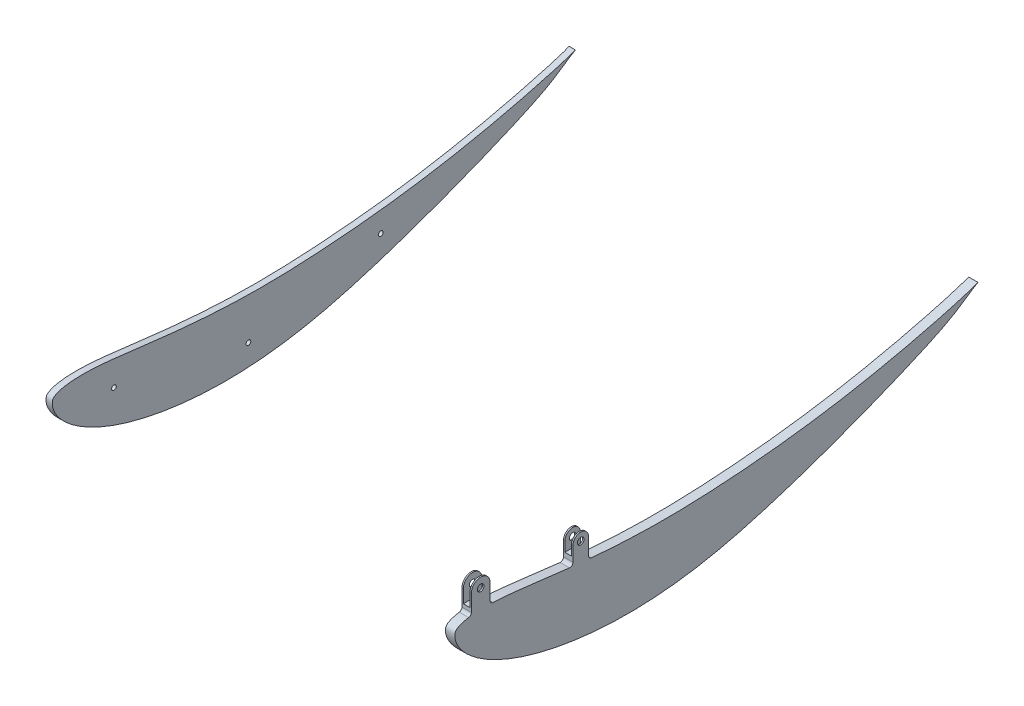
from build123d import *

# Parameters (mm, degrees)
SKETCH10_R          = 3.3782
BOSS_EXTRUDE3_DEPTH = 4.7625
FILLET1_R           = 3.175
SKETCH11_W          = 49.180841289
SKETCH11_H          = 41.157995699
SKETCH11_W_2        = 33.005126503
SKETCH11_H_2        = 27.785711149
CUT_EXTRUDE2_DEPTH  = 3.3782
BOSS_EXTRUDE4_DEPTH = 6.35
SKETCH13_R          = 2.413
CUT_EXTRUDE3_DEPTH  = 6.35


with BuildPart() as part:
    # Sketch10 → Boss-Extrude3 (new, symmetric)
    with BuildSketch(Plane(origin=(-76.913317281, 0, 0), x_dir=(0, 0, -1), z_dir=(1, 0, 0))):
        with BuildLine():
            Line((424.6411251, 925.56881761), (424.6411251, 905.857301798))
            add(Edge.make_bspline(
                [(424.6411251, 905.857301798), (423.945652944, 905.774703814), (420.525882084, 905.325504915), (416.573283914, 904.537907427), (412.940662307, 903.120412878), (411.573177088, 902.472936622), (410.474599814, 901.817379847), (409.794744242, 901.335782482), (409.339677052, 900.920330878), (409.042207277, 900.619525556), (408.784556315, 900.303921905), (408.587304247, 899.955317553), (408.417771895, 899.584396657), (408.237439409, 899.045054034), (408.050985255, 898.323866051), (407.911585152, 897.226493937), (407.859927906, 894.999149718), (408.68651392, 890.840217441), (411.376000996, 884.946014898), (416.25391737, 878.254816024), (423.132675249, 871.411144687), (431.981552695, 864.594650088), (442.753920117, 857.982519555), (455.382043243, 851.727453866), (469.76495433, 845.961461457), (485.786519626, 840.806471362), (503.304073155, 836.369991877), (522.15856297, 832.757498728), (542.167589645, 830.052058954), (563.145876614, 828.350450786), (584.926560949, 827.796453196), (607.349161879, 828.463904852), (630.278164353, 830.40345119), (653.58544904, 833.656986938), (677.184512168, 838.243674796), (700.98973836, 844.111293992), (724.928449617, 850.915307518), (748.823162114, 858.397918758), (772.401865862, 866.368085261), (795.392079425, 874.604570932), (817.507453816, 882.912333682), (838.451534111, 891.127800517), (857.939094567, 899.08092447), (875.67746411, 906.643284295), (891.41607084, 913.715551659), (904.921254426, 920.249689629), (916.209983753, 926.570936945), (924.887186218, 932.328637386), (932.384753705, 937.363798289), (935.676703204, 939.716333859), (940.314704509, 942.154799385), (935.252865423, 940.050693146), (930.971572534, 938.763984852), (920.691607442, 935.460998702), (907.955315783, 931.908700898), (891.294887337, 927.47431092), (871.521761407, 922.604159426), (848.573928973, 917.416460042), (822.769468157, 912.150284242), (794.390431685, 907.047528902), (763.843566945, 902.44822661), (731.632596414, 898.583575164), (698.294192795, 895.504846252), (664.329350338, 893.303833795), (630.291363455, 892.15873472), (596.91773512, 892.45793122), (568.119025793, 893.993021629), (550.570865957, 895.432987488), (543.7036251, 896.066896175)],
                knots=[0.465548295, 0.465548295, 0.465548295, 0.465548295, 0.467425396, 0.47478648, 0.476279685, 0.477883717, 0.478839792, 0.479711359, 0.480113154, 0.480492024, 0.480846456, 0.481202587, 0.481563638, 0.481939612, 0.482727348, 0.483558572, 0.484902837, 0.488691659, 0.494806066, 0.502149414, 0.51079641, 0.520764117, 0.532061881, 0.544665778, 0.558541304, 0.573611819, 0.589802913, 0.607010014, 0.625106992, 0.64396663, 0.663469284, 0.683551422, 0.704141715, 0.725196117, 0.746680345, 0.768632951, 0.790977273, 0.813463266, 0.835826601, 0.857771603, 0.879002655, 0.899227861, 0.918150719, 0.935487385, 0.95098692, 0.964427758, 0.975827857, 0.985423652, 0.993088672, 0.998187309, 1, 1.001841176, 1.007308484, 1.016237151, 1.028456325, 1.043801368, 1.062125827, 1.083239553, 1.106895519, 1.132816624, 1.160612712, 1.18979101, 1.219873156, 1.250457487, 1.281126556, 1.311256566, 1.339998753, 1.35850705, 1.35850705, 1.35850705, 1.35850705], degree=3))
            Line((543.7036251, 896.066896175), (543.7036251, 915.880591264))
            ThreePointArc((543.7036251, 915.880591264), (535.7661251, 923.818091264), (527.8286251, 915.880591264))
            Line((527.8286251, 915.880591264), (527.8286251, 897.654368203))
            add(Edge.make_bspline(
                [(527.8286251, 897.654368203), (521.147965041, 898.371745986), (506.632962869, 900.058010227), (485.466358702, 902.814843608), (465.32608372, 905.166410987), (451.766780725, 906.204699649), (444.906008083, 906.461422369), (443.6911251, 906.496403706)],
                knots=[1.372779583, 1.372779583, 1.372779583, 1.372779583, 1.390812035, 1.411995107, 1.43006872, 1.445223789, 1.448484048, 1.448484048, 1.448484048, 1.448484048], degree=3))
            Line((443.6911251, 906.496403706), (443.6911251, 925.56881761))
            ThreePointArc((443.6911251, 925.56881761), (434.1661251, 935.09381761), (424.6411251, 925.56881761))
        make_face()
        with Locations(Location((434.1661251, 925.56881761, 0), (0, 0, 180))):
            Circle(SKETCH10_R, mode=Mode.SUBTRACT)
        with Locations(Location((535.7661251, 915.880591264, 0), (0, 0, 180))):
            Circle(SKETCH10_R, mode=Mode.SUBTRACT)
    extrude(amount=BOSS_EXTRUDE3_DEPTH, both=True)

    # Fillet1
    fillet1_edges = [part.edges().sort_by_distance(p)[0] for p in [
        (-74.532067281, 897.654368203, -527.8286251),
        (-79.294567281, 896.066896175, -543.7036251),
        (-79.294567281, 906.496403706, -443.6911251),
        (-74.532067281, 905.857301798, -424.6411251),
    ]]
    fillet(fillet1_edges, radius=FILLET1_R)

    # Sketch11 → Cut-Extrude2 (cut, symmetric)
    with BuildSketch(Plane(origin=(-76.913317281, 0, 0), x_dir=(0, 0, -1), z_dir=(1, 0, 0))):
        with Locations((438.21137293, 932.786299648)):
            Rectangle(SKETCH11_W, SKETCH11_H)
        with Locations((537.438895622, 919.849255738)):
            Rectangle(SKETCH11_W_2, SKETCH11_H_2)
    extrude(amount=CUT_EXTRUDE2_DEPTH, both=True, mode=Mode.SUBTRACT)


with BuildPart() as body_2:
    # Sketch12 → Boss-Extrude4 (new body)
    with BuildSketch(Plane(origin=(-487.449999952, 0, 0), x_dir=(0, 0, -1), z_dir=(1, 0, 0))):
        with BuildLine():
            add(Edge.make_bspline(
                [(939.324017067, 941.688873228), (939.308743067, 941.736641366), (935.252865294, 940.050693316), (930.971572408, 938.763985021), (920.691607319, 935.460998869), (907.955315664, 931.908701062), (891.294887224, 927.47431108), (871.5217613, 922.60415958), (848.573928873, 917.41646019), (822.769468065, 912.150284383), (794.390431601, 907.047529035), (763.84356687, 902.448226735), (731.632596348, 898.583575279), (698.294192738, 895.504846357), (664.32935029, 893.30383389), (630.291363415, 892.158734804), (596.917735088, 892.457931293), (565.080468494, 894.154989371), (535.545476386, 896.725674669), (508.889722171, 899.764079767), (485.46635869, 902.814843604), (465.326083714, 905.166410991), (448.372098591, 906.464643697), (434.436838855, 906.716452006), (423.446279524, 905.907425374), (416.573283921, 904.537907439), (412.940662315, 903.120412889), (411.573177097, 902.472936633), (410.474599823, 901.817379858), (409.794744252, 901.335782492), (409.339677062, 900.920330889), (409.042207288, 900.619525567), (408.784556326, 900.303921915), (408.587304258, 899.955317564), (408.417771906, 899.584396667), (408.23743942, 899.045054044), (408.050985267, 898.323866061), (407.911585164, 897.226493948), (407.859927919, 894.99914973), (408.686513934, 890.840217454), (411.376001011, 884.946014913), (416.253917386, 878.254816043), (423.132675266, 871.411144709), (431.981552712, 864.594650115), (442.753920134, 857.982519587), (455.382043258, 851.727453903), (469.764954344, 845.961461501), (485.786519637, 840.806471412), (503.304073163, 836.369991933), (522.158562976, 832.757498791), (542.167589646, 830.052059024), (563.145876611, 828.350450864), (584.926560941, 827.796453281), (607.349161865, 828.463904943), (630.278164333, 830.403451289), (653.585449014, 833.656987043), (677.184512134, 838.243674908), (700.989738319, 844.11129411), (724.928449568, 850.915307643), (748.823162057, 858.397918888), (772.401865797, 866.368085397), (795.392079351, 874.604571074), (817.507453735, 882.912333828), (838.451534022, 891.127800668), (857.939094471, 899.080924626), (875.677464007, 906.643284454), (891.416070731, 913.715551821), (904.921254311, 920.249689794), (916.209983634, 926.570937112), (924.887186095, 932.328637555), (932.384753578, 937.363798459), (935.676703076, 939.71633403), (939.339054759, 941.641844124), (939.324017067, 941.688873228)],
                knots=[0, 0, 0, 0, 0.001841176, 0.007308484, 0.016237151, 0.028456325, 0.043801368, 0.062125827, 0.083239553, 0.106895519, 0.132816624, 0.160612712, 0.18979101, 0.219873156, 0.250457487, 0.281126556, 0.311256566, 0.339998753, 0.36667148, 0.390812035, 0.411995107, 0.43006872, 0.445223789, 0.457619352, 0.467425396, 0.47478648, 0.476279685, 0.477883717, 0.478839792, 0.479711359, 0.480113154, 0.480492024, 0.480846456, 0.481202587, 0.481563638, 0.481939612, 0.482727348, 0.483558572, 0.484902837, 0.488691659, 0.494806066, 0.502149414, 0.51079641, 0.520764117, 0.532061881, 0.544665778, 0.558541304, 0.573611819, 0.589802913, 0.607010014, 0.625106992, 0.64396663, 0.663469284, 0.683551422, 0.704141715, 0.725196117, 0.746680345, 0.768632951, 0.790977273, 0.813463266, 0.835826601, 0.857771603, 0.879002655, 0.899227861, 0.918150719, 0.935487385, 0.95098692, 0.964427758, 0.975827857, 0.985423652, 0.993088672, 0.998187309, 1, 1, 1, 1], degree=3))
        make_face()
    extrude(amount=BOSS_EXTRUDE4_DEPTH)

    # Sketch13 → Cut-Extrude3 (cut)
    with BuildSketch(Plane.ZY.offset(487.449999952)):
        with Locations((-470.539563468, 878.985324241)):
            Circle(SKETCH13_R)
        with Locations((-607.171455672, 850.21400158)):
            Circle(SKETCH13_R)
        with Locations((-741.591661766, 878.985324241)):
            Circle(SKETCH13_R)
    extrude(amount=-CUT_EXTRUDE3_DEPTH, mode=Mode.SUBTRACT)


solid = Compound([part.part, body_2.part])
